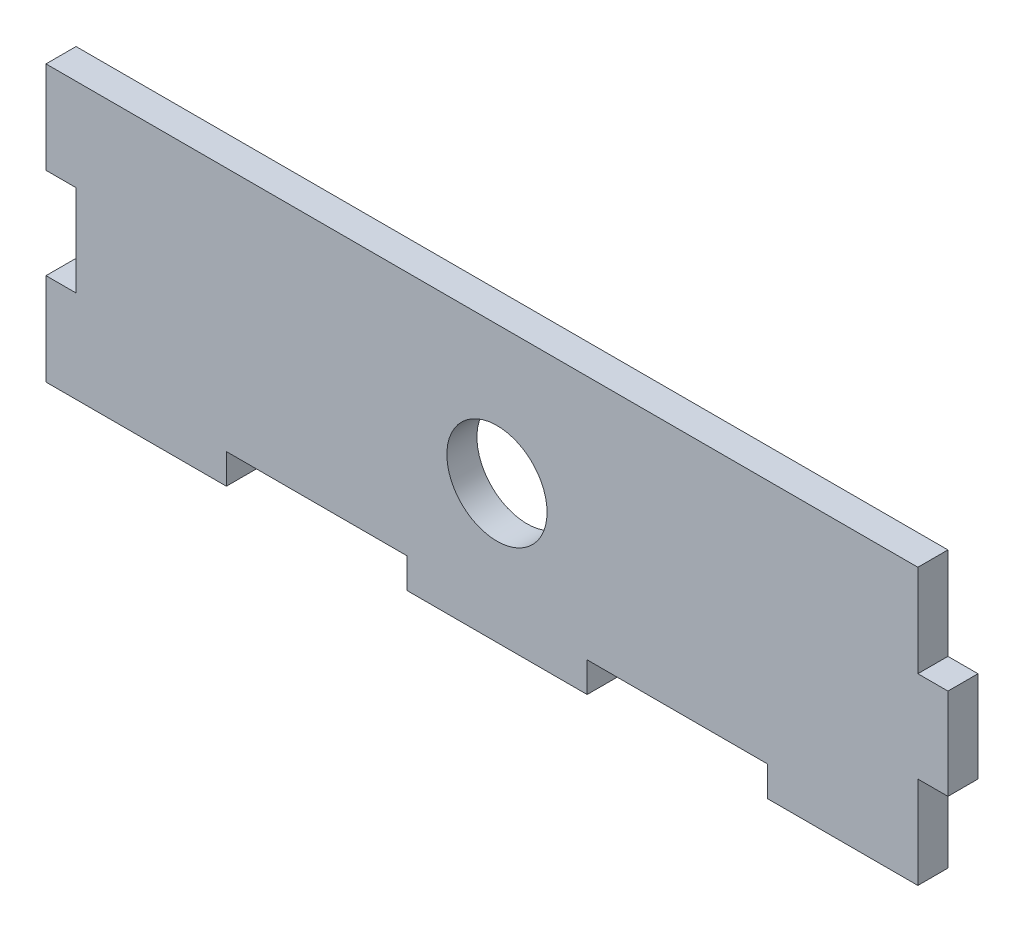
from build123d import *

# Parameters (mm, degrees)
SKETCH1_R           = 5
BOSS_EXTRUDE1_DEPTH = 3


with BuildPart() as part:
    # Sketch1 → Boss-Extrude1 (new body)
    with BuildSketch(Plane.XY):
        Polygon((-42, -4.55), (-45, -4.55), (-45, -13.75), (-27, -13.75), (-27, -10.75), (-9, -10.75), (-9, -13.75), (9, -13.75), (9, -10.75), (27, -10.75), (27, -13.75), (42, -13.75), (42, -4.55), (45, -4.55), (45, 4.55), (42, 4.55), (42, 13.75), (-45, 13.75), (-45, 4.55), (-42, 4.55), align=None)
        Circle(SKETCH1_R, mode=Mode.SUBTRACT)
    extrude(amount=BOSS_EXTRUDE1_DEPTH)


solid = part.part
